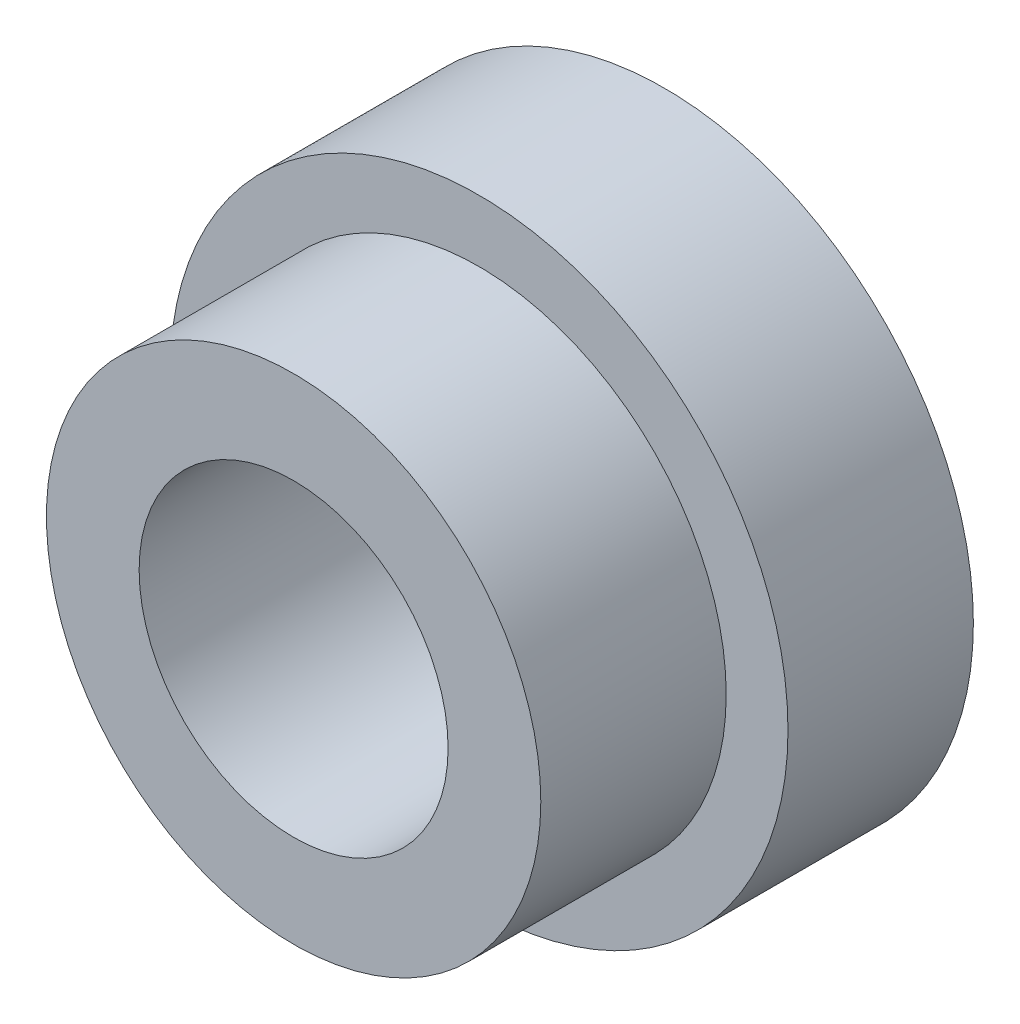
from build123d import *

# Parameters (mm, degrees)
SKETCH1_R           = 5
BOSS_EXTRUDE1_DEPTH = 3
SKETCH2_R           = 4
BOSS_EXTRUDE2_DEPTH = 3
SKETCH3_R           = 2.5
CUT_EXTRUDE1_DEPTH  = 10.273618495


with BuildPart() as part:
    # Sketch1 → Boss-Extrude1 (new body)
    with BuildSketch(Plane.XY):
        Circle(SKETCH1_R)
    extrude(amount=BOSS_EXTRUDE1_DEPTH)

    # Sketch2 → Boss-Extrude2 (add)
    with BuildSketch(Plane.XY.offset(3)):
        Circle(SKETCH2_R)
    extrude(amount=BOSS_EXTRUDE2_DEPTH)

    # Sketch3 → Cut-Extrude1 (cut, through all)
    with BuildSketch(Plane.XY.offset(6)):
        Circle(SKETCH3_R)
    extrude(amount=-CUT_EXTRUDE1_DEPTH, mode=Mode.SUBTRACT)


solid = part.part
